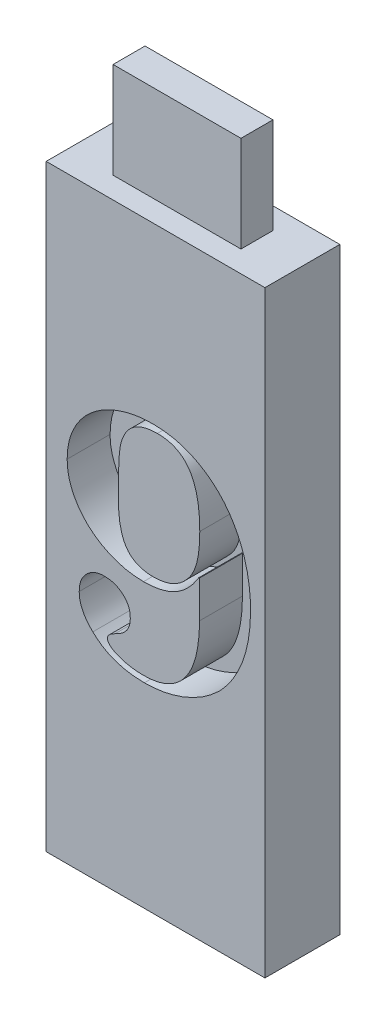
from build123d import *

# Parameters (mm, degrees)
SKETCH1_W           = 17.38
SKETCH1_H           = 47.498
BOSS_EXTRUDE1_DEPTH = 5.95
CUT_EXTRUDE1_DEPTH  = 3.41
SKETCH3_W           = 10.16
SKETCH3_H           = 2.54
BOSS_EXTRUDE2_DEPTH = 7.62


with BuildPart() as part:
    # Sketch1 → Boss-Extrude1 (new body)
    with BuildSketch(Plane.XY):
        Rectangle(SKETCH1_W, SKETCH1_H)
    extrude(amount=BOSS_EXTRUDE1_DEPTH)

    # Sketch2 → Cut-Extrude1 (cut)
    with BuildSketch(Plane.XY.offset(5.95)):
        with BuildLine():
            Line((3.487152068, -1.778161768), (3.487152068, 1.166150972))
            Line((3.487152068, 1.166150972), (3.434908242, 1.166150972))
            add(Edge.make_bspline(
                [(3.434908242, 1.166150972), (3.304108084, 0.962447034), (3.051667405, 0.569304082), (2.606020257, 0.052509765), (2.126124787, -0.377588498), (1.607189304, -0.724954296), (1.041003595, -0.985137942), (0.423940423, -1.167027679), (-0.247798257, -1.281229613), (-0.715507985, -1.293935327), (-0.957304806, -1.300503934)],
                knots=[0, 0, 0, 0, 1.094382657, 2.11212818, 3.0769291, 4.002682782, 4.92692939, 5.884974726, 6.906573123, 8, 8, 8, 8], degree=3))
            add(Edge.make_bspline(
                [(-0.957304806, -1.300503934), (-1.160319729, -1.295599987), (-1.562903441, -1.285875336), (-2.159862823, -1.204303593), (-2.743177905, -1.074296403), (-3.309314589, -0.892251633), (-3.847304465, -0.660530467), (-4.35675467, -0.392306743), (-4.826312838, -0.075942599), (-5.264731702, 0.272006404), (-5.656298214, 0.66205846), (-6.004487104, 1.080981527), (-6.308882076, 1.527892997), (-6.567512155, 2.000163131), (-6.769197554, 2.498845951), (-6.915599652, 3.015296444), (-7.003710796, 3.550186374), (-7.015405354, 3.912356934), (-7.021320272, 4.095536905)],
                knots=[0, 0, 0, 0, 1.08082511, 2.143303443, 3.202451407, 4.260438524, 5.305151229, 6.318733829, 7.321936505, 8.316196843, 9.295244821, 10.259659772, 11.213297776, 12.170793703, 13.121735694, 14.071754215, 15.024724687, 16, 16, 16, 16], degree=3))
            add(Edge.make_bspline(
                [(-7.021320272, 4.095536905), (-7.018210737, 4.231224693), (-7.0120347, 4.500722524), (-6.970134828, 4.898494069), (-6.903138271, 5.287888357), (-6.806288652, 5.665696072), (-6.682576043, 6.035338572), (-6.528984371, 6.392795567), (-6.349564811, 6.740819325), (-6.143518947, 7.077366814), (-5.913366329, 7.400740577), (-5.659079714, 7.707757125), (-5.380805986, 7.995575973), (-5.084363021, 8.267880395), (-4.763431407, 8.518745229), (-4.424274552, 8.754641136), (-4.061179258, 8.971075713), (-3.547061982, 9.234849235), (-2.86692479, 9.512422605), (-2.007061699, 9.751939695), (-1.10525463, 9.896798263), (-0.490133077, 9.915132997), (-0.177379124, 9.924455156)],
                knots=[0, 0, 0, 0, 0.81150523, 1.611780269, 2.389713398, 3.172858926, 3.942206122, 4.718857412, 5.49750176, 6.282236, 7.077062797, 7.86962299, 8.664171169, 9.469926311, 10.275166055, 11.098622506, 11.939473512, 12.801293349, 14.553171055, 16.322216429, 18.130058455, 20, 20, 20, 20], degree=3))
            add(Edge.make_bspline(
                [(-0.177379124, 9.924455156), (0.005584484, 9.920599946), (0.367280681, 9.912978679), (0.903744168, 9.860374141), (1.425678508, 9.769626209), (1.936181762, 9.649314293), (2.427738228, 9.481129576), (2.908546318, 9.289146623), (3.373177619, 9.055435225), (3.82234664, 8.787120998), (4.255353536, 8.490087018), (4.663498203, 8.160853008), (5.042560982, 7.80160222), (5.401741753, 7.418663693), (5.731746906, 7.004482969), (6.040039861, 6.562879869), (6.317988657, 6.090740187), (6.576843628, 5.59645794), (6.802064672, 5.076284734), (7.006268321, 4.539743784), (7.171647104, 3.982671567), (7.312389106, 3.410360603), (7.413655919, 2.818791083), (7.494405543, 2.210401923), (7.538483629, 1.583517236), (7.54430303, 1.159993158), (7.547243654, 0.945980564)],
                knots=[0, 0, 0, 0, 0.992611202, 1.96226835, 2.920848196, 3.865284227, 4.804279565, 5.736655322, 6.672249372, 7.622454472, 8.573402193, 9.51880218, 10.464081727, 11.404748889, 12.364895315, 13.334622912, 14.324178258, 15.335336048, 16.359739057, 17.397613206, 18.448005715, 19.510297648, 20.593183077, 21.702289069, 22.838934782, 24, 24, 24, 24], degree=3))
            add(Edge.make_bspline(
                [(7.547243654, 0.945980564), (7.540785115, 0.608516616), (7.528137842, -0.052313749), (7.408310263, -1.018349864), (7.221179282, -1.937287882), (6.950812342, -2.806644077), (6.607239149, -3.628541958), (6.185486713, -4.401903246), (5.692005287, -5.132206201), (5.299785065, -5.570044923), (5.102978958, -5.78974123)],
                knots=[0, 0, 0, 0, 1.102193129, 2.158342222, 3.175457718, 4.162756, 5.128203624, 6.081208893, 7.037199544, 8, 8, 8, 8], degree=3))
            add(Edge.make_bspline(
                [(5.102978958, -5.78974123), (4.898767616, -5.978012924), (4.492839344, -6.3522566), (3.821725544, -6.839130813), (3.106518262, -7.258352506), (2.351350123, -7.607414458), (1.566910078, -7.884542472), (0.763495023, -8.082747181), (-0.056912958, -8.20144611), (-0.608629498, -8.218138431), (-0.886402471, -8.226542522)],
                knots=[0, 0, 0, 0, 1.005013923, 1.99775174, 2.99498495, 4.002538828, 5.005360414, 6.002685156, 6.994411002, 8, 8, 8, 8], degree=3))
            add(Edge.make_bspline(
                [(-0.886402471, -8.226542522), (-1.09679244, -8.222328969), (-1.508734859, -8.214078855), (-2.109580209, -8.147209466), (-2.675517261, -8.03225956), (-3.20540405, -7.8694113), (-3.705192361, -7.669983544), (-4.170020832, -7.41897553), (-4.598537049, -7.119344634), (-4.855485987, -6.887144089), (-4.983811075, -6.77117881)],
                knots=[0, 0, 0, 0, 1.131740252, 2.215941277, 3.247580916, 4.234124753, 5.194791669, 6.138050347, 7.070107648, 8, 8, 8, 8], degree=3))
            add(Edge.make_bspline(
                [(-4.983811075, -6.77117881), (-5.070039479, -6.686877183), (-5.23843612, -6.52224337), (-5.457345222, -6.255754212), (-5.647818952, -5.987425211), (-5.79680407, -5.70767443), (-5.917186193, -5.424678913), (-6.00531765, -5.134880284), (-6.053413897, -4.837271053), (-6.061788798, -4.636802462), (-6.066004604, -4.535889417)],
                knots=[0, 0, 0, 0, 1.131386578, 2.209500486, 3.233235511, 4.215634249, 5.17868315, 6.117201794, 7.052226095, 8, 8, 8, 8], degree=3))
            add(Edge.make_bspline(
                [(-6.066004604, -4.535889417), (-6.058624797, -4.392224963), (-6.044297658, -4.113315179), (-5.939076346, -3.713290467), (-5.755862621, -3.355419125), (-5.504501994, -3.045264676), (-5.199490873, -2.792262689), (-4.854083632, -2.604723255), (-4.470660918, -2.492728622), (-4.203391551, -2.479214707), (-4.065812426, -2.472258307)],
                knots=[0, 0, 0, 0, 1.072841776, 2.082812137, 3.063757148, 4.055125459, 5.045185952, 6.005754482, 6.973445567, 8, 8, 8, 8], degree=3))
            add(Edge.make_bspline(
                [(-4.065812426, -2.472258307), (-3.923429434, -2.478559217), (-3.647570847, -2.490766855), (-3.252048884, -2.589625018), (-2.895696741, -2.755399411), (-2.585134993, -2.985050732), (-2.325669528, -3.262172999), (-2.137280928, -3.58843514), (-2.026134724, -3.95662603), (-2.012807159, -4.215429395), (-2.005913019, -4.349304326)],
                knots=[0, 0, 0, 0, 1.09414204, 2.119835183, 3.112877638, 4.098424627, 5.073512606, 6.012246659, 6.971766299, 8, 8, 8, 8], degree=3))
            add(Edge.make_bspline(
                [(-2.005913019, -4.349304326), (-2.009489475, -4.441606498), (-2.016366487, -4.61909029), (-2.069433037, -4.875188455), (-2.159810636, -5.107852226), (-2.284565137, -5.323050651), (-2.45481409, -5.515166352), (-2.663360282, -5.696976079), (-2.919286233, -5.864077153), (-3.11065985, -5.959666459), (-3.211252708, -6.009911638)],
                knots=[0, 0, 0, 0, 1.011933835, 1.945803121, 2.852876517, 3.739715247, 4.658715613, 5.654703726, 6.767227912, 8, 8, 8, 8], degree=3))
            add(Edge.make_bspline(
                [(-3.211252708, -6.009911638), (-3.302632114, -6.058298819), (-3.467043464, -6.145357842), (-3.664392741, -6.29655705), (-3.800301136, -6.452152131), (-3.818691815, -6.569157317), (-3.826983509, -6.621910737)],
                knots=[0, 0, 0, 0, 1.365688966, 2.457170339, 3.304393728, 4, 4, 4, 4], degree=3))
            add(Edge.make_bspline(
                [(-3.826983509, -6.621910737), (-3.814210082, -6.695383497), (-3.786476917, -6.854904678), (-3.598304726, -7.063786465), (-3.317494074, -7.249098581), (-2.943300099, -7.420359702), (-2.501127469, -7.564208915), (-2.016285246, -7.67203272), (-1.500107658, -7.73600309), (-1.146562408, -7.744510268), (-0.964768209, -7.748884688)],
                knots=[0, 0, 0, 0, 0.539157403, 1.170597444, 1.98518404, 3.016375408, 4.182129769, 5.400529273, 6.663343096, 8, 8, 8, 8], degree=3))
            add(Edge.make_bspline(
                [(-0.964768209, -7.748884688), (-0.787869424, -7.745173198), (-0.443750813, -7.73795329), (0.056556243, -7.664892493), (0.524447561, -7.548097691), (0.95813629, -7.37717011), (1.359556569, -7.164292496), (1.730871619, -6.905202629), (2.062604604, -6.59195715), (2.364504977, -6.234704012), (2.627247448, -5.829257399), (2.862107796, -5.3821267), (3.052380142, -4.887453965), (3.214697088, -4.35160646), (3.335055193, -3.770556696), (3.42489164, -3.146320562), (3.47615224, -2.476845309), (3.483410264, -2.015832441), (3.487152068, -1.778161768)],
                knots=[0, 0, 0, 0, 1.002475106, 1.950100119, 2.860206143, 3.731235583, 4.586355523, 5.431733106, 6.290104907, 7.166117801, 8.07775314, 9.024196166, 10.024883088, 11.078131633, 12.195910404, 13.385928338, 14.652340935, 16, 16, 16, 16], degree=3))
        make_face()
        with BuildLine():
            add(Edge.make_bspline(
                [(0.139815531, 9.446797322), (-0.002232286, 9.443826963), (-0.277727531, 9.438066088), (-0.675436367, 9.376203665), (-1.042879738, 9.281000486), (-1.378363072, 9.146461893), (-1.682524841, 8.97200324), (-1.955106393, 8.758624046), (-2.199676034, 8.506727338), (-2.328595562, 8.310945004), (-2.394010008, 8.211604018)],
                knots=[0, 0, 0, 0, 1.153056168, 2.236299694, 3.260830098, 4.230944803, 5.163438962, 6.099321436, 7.035585692, 8, 8, 8, 8], degree=3))
            add(Edge.make_bspline(
                [(-2.394010008, 8.211604018), (-2.483211564, 8.037632076), (-2.658408442, 7.695941386), (-2.751392577, 7.323445206), (-2.797033806, 7.140605594)],
                knots=[0, 0, 0, 0, 1.018300743, 2, 2, 2, 2], degree=3))
            add(Edge.make_bspline(
                [(-2.797033806, 7.140605594), (-2.815731393, 7.025094044), (-2.858188147, 6.7628011), (-2.888328732, 6.409636048), (-2.905695983, 6.07337158), (-2.922206367, 5.772448467), (-2.931427401, 5.435215154), (-2.946892954, 4.952669799), (-2.959156001, 4.371745308), (-2.960572574, 3.915176445), (-2.961228686, 3.703708213)],
                knots=[0, 0, 0, 0, 0.815232692, 1.851154993, 2.467578434, 3.1619067, 3.951148237, 4.818365697, 6.526367798, 8, 8, 8, 8], degree=3))
            add(Edge.make_bspline(
                [(-2.961228686, 3.703708213), (-2.960771517, 3.505870507), (-2.959905445, 3.131081377), (-2.927551344, 2.598461033), (-2.885918904, 2.126183401), (-2.82385004, 1.707936824), (-2.735323397, 1.337147662), (-2.633485256, 0.998407036), (-2.502879727, 0.691348637), (-2.396931645, 0.503527308), (-2.345497885, 0.412347203)],
                knots=[0, 0, 0, 0, 1.400524197, 2.653191121, 3.776742533, 4.757083754, 5.643684636, 6.473847711, 7.259111166, 8, 8, 8, 8], degree=3))
            add(Edge.make_bspline(
                [(-2.345497885, 0.412347203), (-2.288150402, 0.332006993), (-2.17499363, 0.173481486), (-1.964760226, -0.028899216), (-1.732765279, -0.203130242), (-1.47124895, -0.34106701), (-1.184380407, -0.450502516), (-0.870859443, -0.526394755), (-0.532301878, -0.577370757), (-0.298238111, -0.58175393), (-0.177379124, -0.584017184)],
                knots=[0, 0, 0, 0, 0.948924908, 1.872397432, 2.797345464, 3.73539212, 4.709988446, 5.747368655, 6.836852258, 8, 8, 8, 8], degree=3))
            add(Edge.make_bspline(
                [(-0.177379124, -0.584017184), (-0.054090604, -0.58125096), (0.188347967, -0.575811367), (0.543074559, -0.530039691), (0.880819676, -0.456439104), (1.19860757, -0.350309008), (1.501152702, -0.221417056), (1.780003012, -0.054229733), (2.046744353, 0.136020083), (2.205166769, 0.287155106), (2.28554408, 0.36383508)],
                knots=[0, 0, 0, 0, 1.090891429, 2.145164517, 3.160247616, 4.145576652, 5.10699423, 6.064368504, 7.01793661, 8, 8, 8, 8], degree=3))
            add(Edge.make_bspline(
                [(2.28554408, 0.36383508), (2.389118727, 0.470813617), (2.597691843, 0.686241306), (2.862584234, 1.059614521), (3.068128511, 1.483185684), (3.239558183, 1.94896284), (3.364479266, 2.471353088), (3.451534509, 3.053130014), (3.502908279, 3.699060313), (3.509709364, 4.150171238), (3.513273981, 4.386609647)],
                knots=[0, 0, 0, 0, 0.8251072, 1.661557006, 2.525409269, 3.428952941, 4.409440598, 5.498297337, 6.688795673, 8, 8, 8, 8], degree=3))
            add(Edge.make_bspline(
                [(3.513273981, 4.386609647), (3.509214967, 4.664123357), (3.501447821, 5.195161075), (3.436958389, 5.951473382), (3.321991813, 6.629377984), (3.163840674, 7.23030522), (2.959698502, 7.75953804), (2.706719041, 8.217085842), (2.400771711, 8.601617182), (2.043811076, 8.913296837), (1.637864249, 9.155266345), (1.182527988, 9.328599856), (0.676589926, 9.429133069), (0.323130915, 9.440764752), (0.139815531, 9.446797322)],
                knots=[0, 0, 0, 0, 1.442495809, 2.76029491, 3.94135525, 5.01266688, 5.985295064, 6.882800448, 7.719973951, 8.526572343, 9.332781858, 10.163789453, 11.047681257, 12, 12, 12, 12], degree=3))
        make_face(mode=Mode.SUBTRACT)
    extrude(amount=-CUT_EXTRUDE1_DEPTH, mode=Mode.SUBTRACT)

    # Sketch3 → Boss-Extrude2 (add)
    with BuildSketch(Plane(origin=(0, 23.749, 0), x_dir=(1, 0, 0), z_dir=(0, 1, 0))):
        with Locations((0, -2.975)):
            Rectangle(SKETCH3_W, SKETCH3_H)
    extrude(amount=BOSS_EXTRUDE2_DEPTH)


solid = part.part
